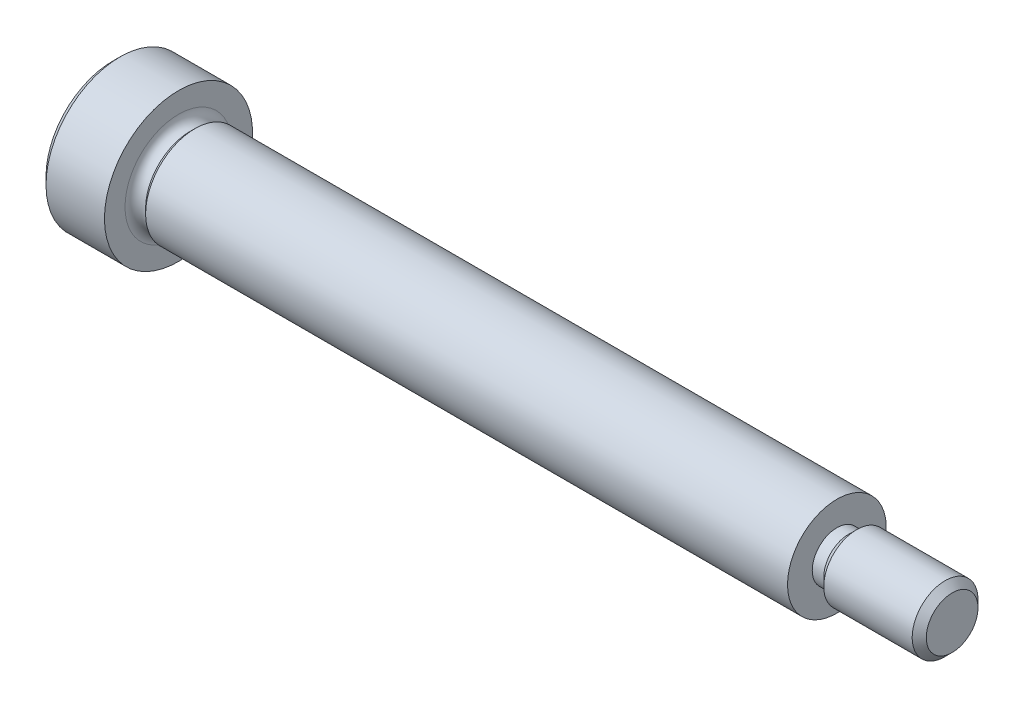
from build123d import *

# Parameters (mm, degrees)
ENL_V_MAT_EXTRU_1_DEPTH = 2


with BuildPart() as part:
    # Esquisse1 → Révolution1 (revolve)
    with BuildSketch(Plane.XY, mode=Mode.PRIVATE) as r_volution1_sk:
        with BuildLine():
            Line((-1.133974596, 0), (-2, 1.5))
            Line((-2, 1.5), (-4, 1.5))
            Line((-4, 1.5), (-4, 4.05))
            Line((-4, 4.05), (-3.55, 4.5))
            Line((-3.55, 4.5), (0, 4.5))
            Line((0, 4.5), (0, 3.25))
            ThreePointArc((0, 3.25), (0.219643047, 2.809091151), (0.7, 2.7))
            Line((0.7, 2.7), (1, 3))
            Line((1, 3), (40, 3))
            Line((40, 3), (40, 1.5))
            Line((40, 1.5), (40.7, 1.5))
            Line((40.7, 1.5), (41.2, 2))
            Line((41.2, 2), (46.5705, 2))
            Line((46.5705, 2), (47, 1.5705))
            Line((47, 1.5705), (47, 0))
            Line((47, 0), (-1.133974596, 0))
        make_face()
    revolve(r_volution1_sk.sketch.rotate(Axis((47, 0, 0), (-1, 0, 0)), 270), axis=Axis((47, 0, 0), (-1, 0, 0)))

    # Esquisse2 → Enlèv. mat.-Extru.1 (cut)
    with BuildSketch(Plane(origin=(-4, 0, 0), x_dir=(0, 0, -1), z_dir=(1, 0, 0))):
        Polygon((-1.5, 0.866025404), (-1.5, -0.866025404), (0, -1.732050808), (1.5, -0.866025404), (1.5, 0.866025404), (0, 1.732050808), align=None)
    extrude(amount=ENL_V_MAT_EXTRU_1_DEPTH, mode=Mode.SUBTRACT)


solid = part.part
